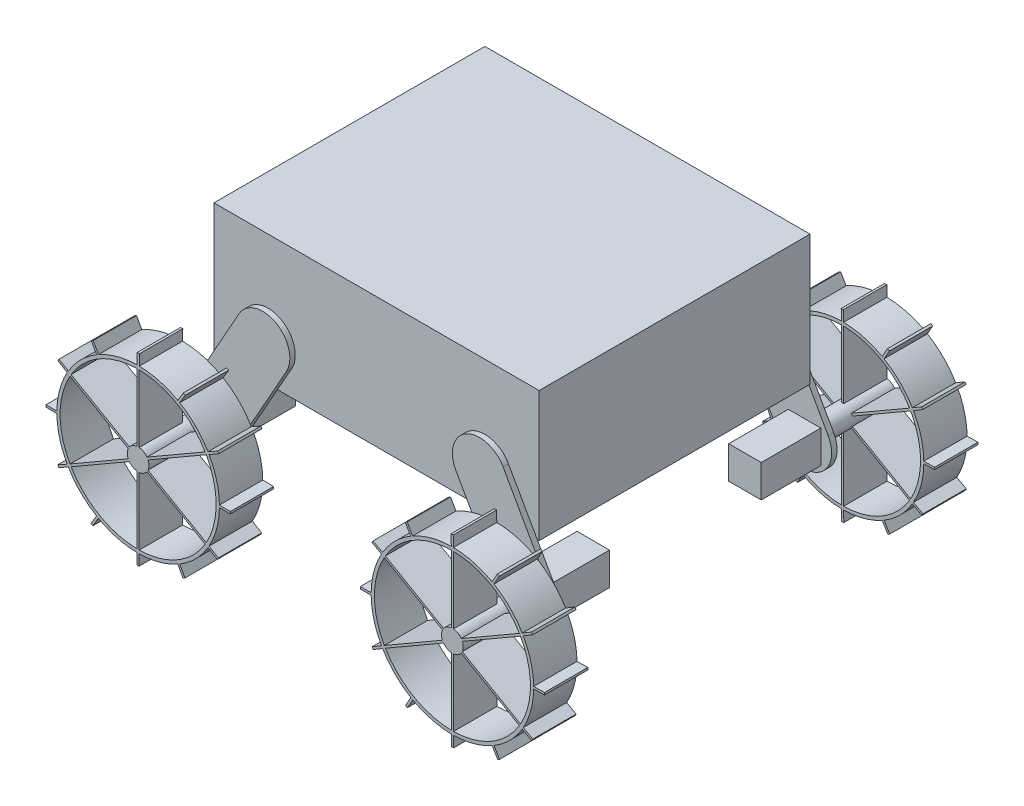
from build123d import *

# Parameters (mm, degrees)
SKETCH1_W                = 300
SKETCH1_H                = 250
SKETCH1_W_2              = 298
SKETCH1_H_2              = 248
BOSS_EXTRUDE1_DEPTH      = 120
SKETCH2_W                = 298
SKETCH2_H                = 248
BOSS_EXTRUDE2_DEPTH      = 1
SKETCH3_W                = 298
SKETCH3_H                = 248
BOSS_EXTRUDE3_DEPTH      = 1
BOSS_EXTRUDE4_DEPTH      = 5
SKETCH6_R                = 10
BOSS_EXTRUDE6_DEPTH      = 30
BOSS_EXTRUDE5_DEPTH      = 40
SKETCH7_R                = 10
BOSS_EXTRUDE7_DEPTH      = 40
MIRROR9_COPY_1_SKETCH_R  = 10
MIRROR9_COPY_1_DEPTH     = 30
MIRROR9_COPY_2_DEPTH     = 40
MIRROR9_COPY_3_SKETCH_R  = 10
MIRROR9_COPY_3_DEPTH     = 40
SKETCH13_W               = 30
SKETCH13_H               = 30
BOSS_EXTRUDE9_DEPTH      = 55
MIRROR11_COPY_1_SKETCH_W = 30
MIRROR11_COPY_1_SKETCH_H = 30
MIRROR11_COPY_1_DEPTH    = 55


with BuildPart() as part:
    # Sketch1 → Boss-Extrude1 (new body)
    with BuildSketch(Plane(origin=(0, 0, 0), x_dir=(1, 0, 0), z_dir=(0, 1, 0))):
        Rectangle(SKETCH1_W, SKETCH1_H)
        Rectangle(SKETCH1_W_2, SKETCH1_H_2, mode=Mode.SUBTRACT)
    extrude(amount=BOSS_EXTRUDE1_DEPTH)

    # Sketch2 → Boss-Extrude2 (add)
    with BuildSketch(Plane(origin=(0, 0, 0), x_dir=(1, 0, 0), z_dir=(0, 1, 0))):
        Rectangle(SKETCH2_W, SKETCH2_H)
    extrude(amount=BOSS_EXTRUDE2_DEPTH)

    # Sketch3 → Boss-Extrude3 (add)
    with BuildSketch(Plane(origin=(0, 120, 0), x_dir=(1, 0, 0), z_dir=(0, 1, 0))):
        Rectangle(SKETCH3_W, SKETCH3_H)
    extrude(amount=-BOSS_EXTRUDE3_DEPTH)

    # Sketch4 → Boss-Extrude4 (add)
    with BuildSketch(Plane.XY.offset(125)):
        with BuildLine():
            Line((-148.809338526, 0), (-166.789388428, -31.964533159))
            ThreePointArc((-166.789388428, -31.964533159), (-157.256530991, -66.010452578), (-123.210611572, -56.477595141))
            Line((-123.210611572, -56.477595141), (-91.441964305, 0))
            Line((-91.441964305, 0), (-148.809338526, 0))
        make_face()
        with BuildLine():
            Line((-121.789388428, 48.035466841), (-148.809338526, 0))
            Line((-148.809338526, 0), (-91.441964305, 0))
            Line((-91.441964305, 0), (-78.210611572, 23.522404859))
            ThreePointArc((-78.210611572, 23.522404859), (-75.815969001, 29.443902729), (-75, 35.77893585))
            ThreePointArc((-75, 35.77893585), (-93.664966879, 59.962966849), (-121.789388428, 48.035466841))
        make_face()
        with BuildLine():
            Line((78.210611572, 22.743469009), (91.00381289, 0))
            Line((91.00381289, 0), (148.37118711, 0))
            Line((148.37118711, 0), (121.789388428, 47.256530991))
            ThreePointArc((121.789388428, 47.256530991), (93.664966879, 59.184030999), (75, 35))
            ThreePointArc((75, 35), (75.815969001, 28.664966879), (78.210611572, 22.743469009))
        make_face()
        with BuildLine():
            Line((148.37118711, 0), (91.00381289, 0))
            Line((91.00381289, 0), (123.210611572, -57.256530991))
            ThreePointArc((123.210611572, -57.256530991), (157.256530991, -66.789388428), (166.789388428, -32.743469009))
            Line((166.789388428, -32.743469009), (148.37118711, 0))
        make_face()
    boss_extrude4 = extrude(amount=BOSS_EXTRUDE4_DEPTH)

    # Sketch6 → Boss-Extrude6 (add)
    with BuildSketch(Plane.XY.offset(130)):
        with Locations((145, -45)):
            Circle(SKETCH6_R)
    boss_extrude6 = extrude(amount=BOSS_EXTRUDE6_DEPTH)

    # Sketch5 → Boss-Extrude5 (add)
    with BuildSketch(Plane.XY.offset(160)):
        with BuildLine():
            Line((219.038797062, -3.199802277), (218.014839557, -1.481806053))
            Line((218.014839557, -1.481806053), (209.424858433, -6.601593576))
            ThreePointArc((209.424858433, -6.601593576), (198.003668885, 8.06233207), (183.327118508, 19.467293932))
            Line((183.327118508, 19.467293932), (188.21938026, 28.219431642))
            Line((188.21938026, 28.219431642), (186.473608936, 29.195281264))
            Line((186.473608936, 29.195281264), (181.594360826, 20.466424645))
            ThreePointArc((181.594360826, 20.466424645), (164.371357713, 27.455161999), (145.958611315, 29.993873512))
            Line((145.958611315, 29.993873512), (145.81936542, 40.019577982))
            Line((145.81936542, 40.019577982), (143.819558293, 39.991802883))
            Line((143.819558293, 39.991802883), (143.958433788, 29.99276725))
            ThreePointArc((143.958433788, 29.99276725), (125.548506885, 27.433689783), (108.333244995, 20.425905247))
            Line((108.333244995, 20.425905247), (103.199802277, 29.038797062))
            Line((103.199802277, 29.038797062), (101.481806053, 28.014839557))
            Line((101.481806053, 28.014839557), (106.601593576, 19.424858433))
            ThreePointArc((106.601593576, 19.424858433), (91.93766793, 8.003668885), (80.532706068, -6.672881492))
            Line((80.532706068, -6.672881492), (71.780568358, -1.78061974))
            Line((71.780568358, -1.78061974), (70.804718736, -3.526391064))
            Line((70.804718736, -3.526391064), (79.533575355, -8.405639174))
            ThreePointArc((79.533575355, -8.405639174), (72.544838001, -25.628642287), (70.006126488, -44.041388685))
            Line((70.006126488, -44.041388685), (59.980422018, -44.18063458))
            Line((59.980422018, -44.18063458), (60.008197117, -46.180441707))
            Line((60.008197117, -46.180441707), (70.00723275, -46.041566212))
            ThreePointArc((70.00723275, -46.041566212), (72.566310217, -64.451493115), (79.574094753, -81.666755005))
            Line((79.574094753, -81.666755005), (70.961202938, -86.800197723))
            Line((70.961202938, -86.800197723), (71.985160443, -88.518193947))
            Line((71.985160443, -88.518193947), (80.575141567, -83.398406424))
            ThreePointArc((80.575141567, -83.398406424), (91.996331115, -98.06233207), (106.672881492, -109.467293932))
            Line((106.672881492, -109.467293932), (101.78061974, -118.219431642))
            Line((101.78061974, -118.219431642), (103.526391064, -119.195281264))
            Line((103.526391064, -119.195281264), (108.405639174, -110.466424645))
            ThreePointArc((108.405639174, -110.466424645), (125.628642287, -117.455161999), (144.041388685, -119.993873512))
            Line((144.041388685, -119.993873512), (144.18063458, -130.019577982))
            Line((144.18063458, -130.019577982), (146.180441707, -129.991802883))
            Line((146.180441707, -129.991802883), (146.041566212, -119.99276725))
            ThreePointArc((146.041566212, -119.99276725), (164.451493115, -117.433689783), (181.666755005, -110.425905247))
            Line((181.666755005, -110.425905247), (186.800197723, -119.038797062))
            Line((186.800197723, -119.038797062), (188.518193947, -118.014839557))
            Line((188.518193947, -118.014839557), (183.398406424, -109.424858433))
            ThreePointArc((183.398406424, -109.424858433), (198.06233207, -98.003668885), (209.467293932, -83.327118508))
            Line((209.467293932, -83.327118508), (218.219431642, -88.21938026))
            Line((218.219431642, -88.21938026), (219.195281264, -86.473608936))
            Line((219.195281264, -86.473608936), (210.466424645, -81.594360826))
            ThreePointArc((210.466424645, -81.594360826), (217.455161999, -64.371357713), (219.993873512, -45.958611315))
            Line((219.993873512, -45.958611315), (230.019577982, -45.81936542))
            Line((230.019577982, -45.81936542), (229.991802883, -43.819558293))
            Line((229.991802883, -43.819558293), (219.99276725, -43.958433788))
            ThreePointArc((219.99276725, -43.958433788), (217.433689783, -25.548506885), (210.425905247, -8.333244995))
            Line((210.425905247, -8.333244995), (219.038797062, -3.199802277))
        make_face()
        with BuildLine():
            Line((83.152185283, -81.862553014), (144, -46.732050808))
            Line((144, -46.732050808), (144, -116.993055221))
            ThreePointArc((144, -116.993055221), (109, -107.353829072), (83.152185283, -81.862553014))
        make_face(mode=Mode.SUBTRACT)
        with BuildLine():
            Line((146, -116.993055221), (146, -46.732050808))
            Line((146, -46.732050808), (206.847814717, -81.862553014))
            ThreePointArc((206.847814717, -81.862553014), (181, -107.353829072), (146, -116.993055221))
        make_face(mode=Mode.SUBTRACT)
        with BuildLine():
            Line((82.152185283, -9.869497793), (143, -45))
            Line((143, -45), (82.152185283, -80.130502207))
            ThreePointArc((82.152185283, -80.130502207), (73, -45), (82.152185283, -9.869497793))
        make_face(mode=Mode.SUBTRACT)
        with BuildLine():
            Line((144, 26.993055221), (144, -43.267949192))
            Line((144, -43.267949192), (83.152185283, -8.137446986))
            ThreePointArc((83.152185283, -8.137446986), (109, 17.353829072), (144, 26.993055221))
        make_face(mode=Mode.SUBTRACT)
        with BuildLine():
            Line((207.847814717, -80.130502207), (147, -45))
            Line((147, -45), (207.847814717, -9.869497793))
            ThreePointArc((207.847814717, -9.869497793), (217, -45), (207.847814717, -80.130502207))
        make_face(mode=Mode.SUBTRACT)
        with BuildLine():
            Line((206.847814717, -8.137446986), (146, -43.267949192))
            Line((146, -43.267949192), (146, 26.993055221))
            ThreePointArc((146, 26.993055221), (181, 17.353829072), (206.847814717, -8.137446986))
        make_face(mode=Mode.SUBTRACT)
    boss_extrude5 = extrude(amount=BOSS_EXTRUDE5_DEPTH)

    # Sketch7 → Boss-Extrude7 (add)
    with BuildSketch(Plane.XY.offset(160)):
        with Locations(Location((145, -45, 0), (0, 0, 204.260829523))):
            Circle(SKETCH7_R)
    boss_extrude7 = extrude(amount=BOSS_EXTRUDE7_DEPTH)

    # Mirror8: Boss-Extrude6, Boss-Extrude5, Boss-Extrude7 across plane
    add(boss_extrude6.mirror(Plane(origin=(0, 0, 0), x_dir=(0, 0, 1), z_dir=(1, 0, 0))))
    add(boss_extrude5.mirror(Plane(origin=(0, 0, 0), x_dir=(0, 0, 1), z_dir=(1, 0, 0))))
    add(boss_extrude7.mirror(Plane(origin=(0, 0, 0), x_dir=(0, 0, 1), z_dir=(1, 0, 0))))

    # Mirror9: Boss-Extrude4, Boss-Extrude6, Boss-Extrude5, Boss-Extrude7 across plane
    add(boss_extrude4.mirror(Plane.XY))
    add(boss_extrude6.mirror(Plane.XY))
    add(boss_extrude5.mirror(Plane.XY))
    add(boss_extrude7.mirror(Plane.XY))

    # Mirror9 copy 1 sketch → Mirror9 copy 1 (add)
    with BuildSketch(Plane(origin=(0, 0, -130), x_dir=(-1, 0, 0), z_dir=(0, 0, -1))):
        with Locations((145, -45)):
            Circle(MIRROR9_COPY_1_SKETCH_R)
    extrude(amount=MIRROR9_COPY_1_DEPTH)

    # Mirror9 copy 2 sketch → Mirror9 copy 2 (add)
    with BuildSketch(Plane(origin=(0, 0, -160), x_dir=(-1, 0, 0), z_dir=(0, 0, -1))):
        with BuildLine():
            Line((219.038797062, -3.199802277), (218.014839557, -1.481806053))
            Line((218.014839557, -1.481806053), (209.424858433, -6.601593576))
            ThreePointArc((209.424858433, -6.601593576), (198.003668885, 8.06233207), (183.327118508, 19.467293932))
            Line((183.327118508, 19.467293932), (188.21938026, 28.219431642))
            Line((188.21938026, 28.219431642), (186.473608936, 29.195281264))
            Line((186.473608936, 29.195281264), (181.594360826, 20.466424645))
            ThreePointArc((181.594360826, 20.466424645), (164.371357713, 27.455161999), (145.958611315, 29.993873512))
            Line((145.958611315, 29.993873512), (145.81936542, 40.019577982))
            Line((145.81936542, 40.019577982), (143.819558293, 39.991802883))
            Line((143.819558293, 39.991802883), (143.958433788, 29.99276725))
            ThreePointArc((143.958433788, 29.99276725), (125.548506885, 27.433689783), (108.333244995, 20.425905247))
            Line((108.333244995, 20.425905247), (103.199802277, 29.038797062))
            Line((103.199802277, 29.038797062), (101.481806053, 28.014839557))
            Line((101.481806053, 28.014839557), (106.601593576, 19.424858433))
            ThreePointArc((106.601593576, 19.424858433), (91.93766793, 8.003668885), (80.532706068, -6.672881492))
            Line((80.532706068, -6.672881492), (71.780568358, -1.78061974))
            Line((71.780568358, -1.78061974), (70.804718736, -3.526391064))
            Line((70.804718736, -3.526391064), (79.533575355, -8.405639174))
            ThreePointArc((79.533575355, -8.405639174), (72.544838001, -25.628642287), (70.006126488, -44.041388685))
            Line((70.006126488, -44.041388685), (59.980422018, -44.18063458))
            Line((59.980422018, -44.18063458), (60.008197117, -46.180441707))
            Line((60.008197117, -46.180441707), (70.00723275, -46.041566212))
            ThreePointArc((70.00723275, -46.041566212), (72.566310217, -64.451493115), (79.574094753, -81.666755005))
            Line((79.574094753, -81.666755005), (70.961202938, -86.800197723))
            Line((70.961202938, -86.800197723), (71.985160443, -88.518193947))
            Line((71.985160443, -88.518193947), (80.575141567, -83.398406424))
            ThreePointArc((80.575141567, -83.398406424), (91.996331115, -98.06233207), (106.672881492, -109.467293932))
            Line((106.672881492, -109.467293932), (101.78061974, -118.219431642))
            Line((101.78061974, -118.219431642), (103.526391064, -119.195281264))
            Line((103.526391064, -119.195281264), (108.405639174, -110.466424645))
            ThreePointArc((108.405639174, -110.466424645), (125.628642287, -117.455161999), (144.041388685, -119.993873512))
            Line((144.041388685, -119.993873512), (144.18063458, -130.019577982))
            Line((144.18063458, -130.019577982), (146.180441707, -129.991802883))
            Line((146.180441707, -129.991802883), (146.041566212, -119.99276725))
            ThreePointArc((146.041566212, -119.99276725), (164.451493115, -117.433689783), (181.666755005, -110.425905247))
            Line((181.666755005, -110.425905247), (186.800197723, -119.038797062))
            Line((186.800197723, -119.038797062), (188.518193947, -118.014839557))
            Line((188.518193947, -118.014839557), (183.398406424, -109.424858433))
            ThreePointArc((183.398406424, -109.424858433), (198.06233207, -98.003668885), (209.467293932, -83.327118508))
            Line((209.467293932, -83.327118508), (218.219431642, -88.21938026))
            Line((218.219431642, -88.21938026), (219.195281264, -86.473608936))
            Line((219.195281264, -86.473608936), (210.466424645, -81.594360826))
            ThreePointArc((210.466424645, -81.594360826), (217.455161999, -64.371357713), (219.993873512, -45.958611315))
            Line((219.993873512, -45.958611315), (230.019577982, -45.81936542))
            Line((230.019577982, -45.81936542), (229.991802883, -43.819558293))
            Line((229.991802883, -43.819558293), (219.99276725, -43.958433788))
            ThreePointArc((219.99276725, -43.958433788), (217.433689783, -25.548506885), (210.425905247, -8.333244995))
            Line((210.425905247, -8.333244995), (219.038797062, -3.199802277))
        make_face()
        with BuildLine():
            Line((83.152185283, -81.862553014), (144, -46.732050808))
            Line((144, -46.732050808), (144, -116.993055221))
            ThreePointArc((144, -116.993055221), (109, -107.353829072), (83.152185283, -81.862553014))
        make_face(mode=Mode.SUBTRACT)
        with BuildLine():
            Line((146, -116.993055221), (146, -46.732050808))
            Line((146, -46.732050808), (206.847814717, -81.862553014))
            ThreePointArc((206.847814717, -81.862553014), (181, -107.353829072), (146, -116.993055221))
        make_face(mode=Mode.SUBTRACT)
        with BuildLine():
            Line((82.152185283, -9.869497793), (143, -45))
            Line((143, -45), (82.152185283, -80.130502207))
            ThreePointArc((82.152185283, -80.130502207), (73, -45), (82.152185283, -9.869497793))
        make_face(mode=Mode.SUBTRACT)
        with BuildLine():
            Line((144, 26.993055221), (144, -43.267949192))
            Line((144, -43.267949192), (83.152185283, -8.137446986))
            ThreePointArc((83.152185283, -8.137446986), (109, 17.353829072), (144, 26.993055221))
        make_face(mode=Mode.SUBTRACT)
        with BuildLine():
            Line((207.847814717, -80.130502207), (147, -45))
            Line((147, -45), (207.847814717, -9.869497793))
            ThreePointArc((207.847814717, -9.869497793), (217, -45), (207.847814717, -80.130502207))
        make_face(mode=Mode.SUBTRACT)
        with BuildLine():
            Line((206.847814717, -8.137446986), (146, -43.267949192))
            Line((146, -43.267949192), (146, 26.993055221))
            ThreePointArc((146, 26.993055221), (181, 17.353829072), (206.847814717, -8.137446986))
        make_face(mode=Mode.SUBTRACT)
    extrude(amount=MIRROR9_COPY_2_DEPTH)

    # Mirror9 copy 3 sketch → Mirror9 copy 3 (add)
    with BuildSketch(Plane(origin=(0, 0, -160), x_dir=(-1, 0, 0), z_dir=(0, 0, -1))):
        with Locations(Location((145, -45, 0), (0, 0, 204.260829523))):
            Circle(MIRROR9_COPY_3_SKETCH_R)
    extrude(amount=MIRROR9_COPY_3_DEPTH)

    # Sketch13 → Boss-Extrude9 (add)
    with BuildSketch(Plane.XY.offset(-125)):
        with Locations((145, -45)):
            Rectangle(SKETCH13_W, SKETCH13_H)
    boss_extrude9 = extrude(amount=BOSS_EXTRUDE9_DEPTH)

    # Mirror10: Boss-Extrude9 across plane
    add(boss_extrude9.mirror(Plane(origin=(0, 0, 0), x_dir=(0, 0, 1), z_dir=(1, 0, 0))))

    # Mirror11: Boss-Extrude9 across plane
    add(boss_extrude9.mirror(Plane.XY))

    # Mirror11 copy 1 sketch → Mirror11 copy 1 (add)
    with BuildSketch(Plane(origin=(0, 0, 125), x_dir=(-1, 0, 0), z_dir=(0, 0, -1))):
        with Locations((145, -45)):
            Rectangle(MIRROR11_COPY_1_SKETCH_W, MIRROR11_COPY_1_SKETCH_H)
    extrude(amount=MIRROR11_COPY_1_DEPTH)


solid = part.part
